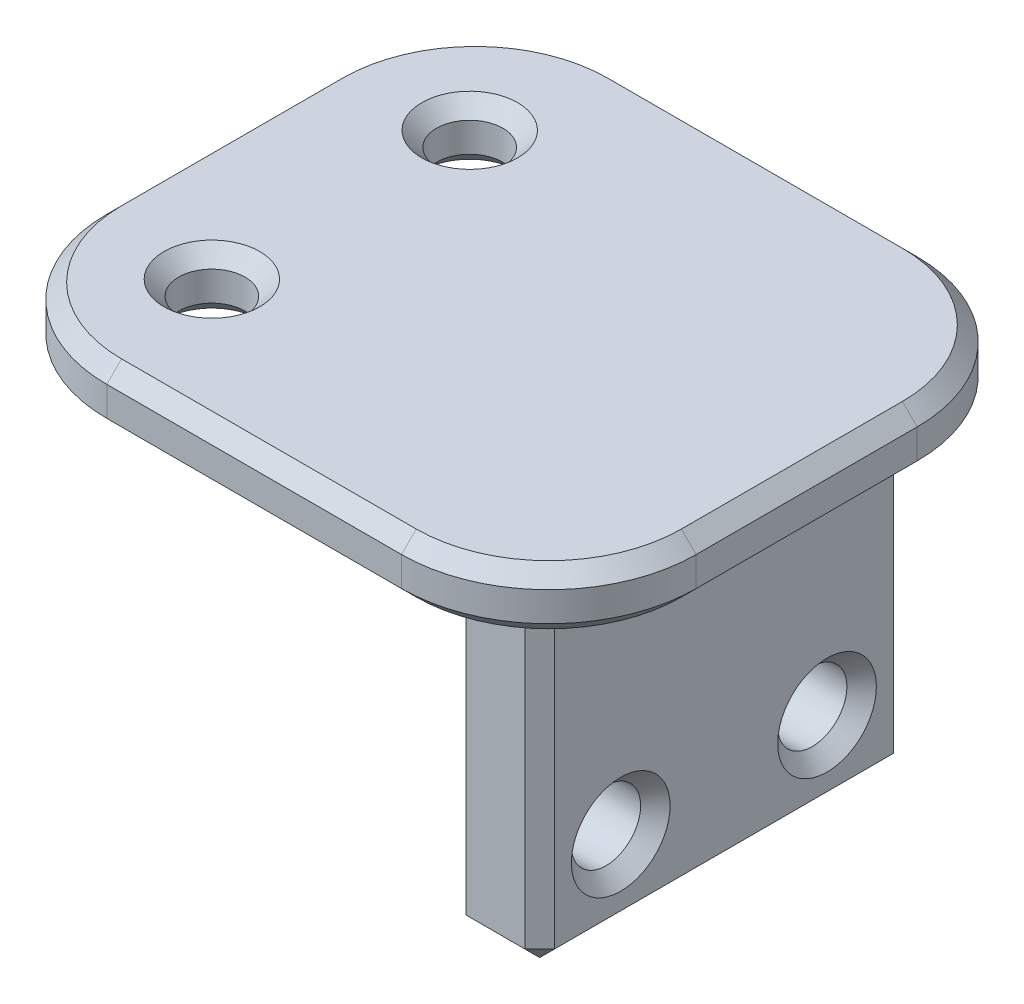
from build123d import *

# Parameters (mm, degrees)
SKETCH1_W           = 40
SKETCH1_H           = 35
SKETCH1_R           = 2.25
SKETCH1_W_2         = 6
SKETCH1_H_2         = 25
BOSS_EXTRUDE1_DEPTH = 4
SKETCH2_W           = 6
SKETCH2_H           = 25
BOSS_EXTRUDE2_DEPTH = 26
SKETCH3_R           = 2.35
CUT_EXTRUDE1_DEPTH  = 45.760529843
FILLET1_R           = 10
CHAMFER1_SIZE       = 1


with BuildPart() as part:
    # Sketch1 → Boss-Extrude1 (new body)
    with BuildSketch(Plane(origin=(0, 0, 0), x_dir=(1, 0, 0), z_dir=(0, 1, 0))):
        with Locations((-0.498134051, -0.87173459)):
            Rectangle(SKETCH1_W, SKETCH1_H)
        with Locations(Location((-12.118134051, -9.62173459, 0), (0, 0, 270))):
            Circle(SKETCH1_R, mode=Mode.SUBTRACT)
        with Locations(Location((-12.118134051, 7.87826541, 0), (0, 0, 270))):
            Circle(SKETCH1_R, mode=Mode.SUBTRACT)
        with Locations((10.881865949, -0.87173459)):
            Rectangle(SKETCH1_W_2, SKETCH1_H_2, mode=Mode.SUBTRACT)
    extrude(amount=BOSS_EXTRUDE1_DEPTH)

    # Sketch2 → Boss-Extrude2 (add)
    with BuildSketch(Plane(origin=(0, 4, 0), x_dir=(1, 0, 0), z_dir=(0, 1, 0))):
        with Locations((10.881865949, -0.87173459)):
            Rectangle(SKETCH2_W, SKETCH2_H)
    extrude(amount=-BOSS_EXTRUDE2_DEPTH)

    # Sketch3 → Cut-Extrude1 (cut, through all)
    with BuildSketch(Plane(origin=(13.881865949, 0, 0), x_dir=(0, 0, -1), z_dir=(1, 0, 0))):
        with Locations((6.12826541, -16.5)):
            Circle(SKETCH3_R)
        with Locations(Location((-7.87173459, -16.5, 0), (0, 0, 180))):
            Circle(SKETCH3_R)
    extrude(amount=-CUT_EXTRUDE1_DEPTH, mode=Mode.SUBTRACT)

    # Fillet1
    fillet1_edges = [part.edges().sort_by_distance(p)[0] for p in [
        (19.501865949, 2, 18.37173459),
        (-20.498134051, 2, 18.37173459),
        (-20.498134051, 2, -16.62826541),
        (19.501865949, 2, -16.62826541),
    ]]
    fillet(fillet1_edges, radius=FILLET1_R)

    # Chamfer1
    chamfer1_edges = [part.edges().sort_by_distance(p)[0] for p in [
        (-12.118134051, 0, 7.37173459),
        (-12.118134051, 4, 7.37173459),
        (-12.118134051, 0, -10.12826541),
        (-12.118134051, 4, -10.12826541),
        (7.881865949, -11, -11.62826541),
        (10.881865949, -22, -11.62826541),
        (13.881865949, -11, -11.62826541),
        (13.881865949, -22, 0.87173459),
        (13.881865949, -11, 13.37173459),
        (10.881865949, -22, 13.37173459),
        (7.881865949, -11, 13.37173459),
        (7.881865949, -22, 0.87173459),
        (7.881865949, -16.5, -3.77826541),
        (13.881865949, -16.5, -3.77826541),
        (7.881865949, -16.5, 5.52173459),
        (13.881865949, -16.5, 5.52173459),
        (19.501865949, 0, 0.87173459),
        (19.501865949, 4, 0.87173459),
        (-0.498134051, 0, 18.37173459),
        (-20.498134051, 0, 0.87173459),
        (-0.498134051, 0, -16.62826541),
        (-17.569201863, 0, 15.442802401),
        (-17.569201863, 0, -13.699333222),
        (16.572933761, 0, -13.699333222),
        (16.572933761, 0, 15.442802401),
        (-0.498134051, 4, 18.37173459),
        (-0.498134051, 4, -16.62826541),
        (-20.498134051, 4, 0.87173459),
        (-17.569201863, 4, 15.442802401),
        (-17.569201863, 4, -13.699333222),
        (16.572933761, 4, -13.699333222),
        (16.572933761, 4, 15.442802401),
    ]]
    chamfer(chamfer1_edges, length=CHAMFER1_SIZE)


solid = part.part
